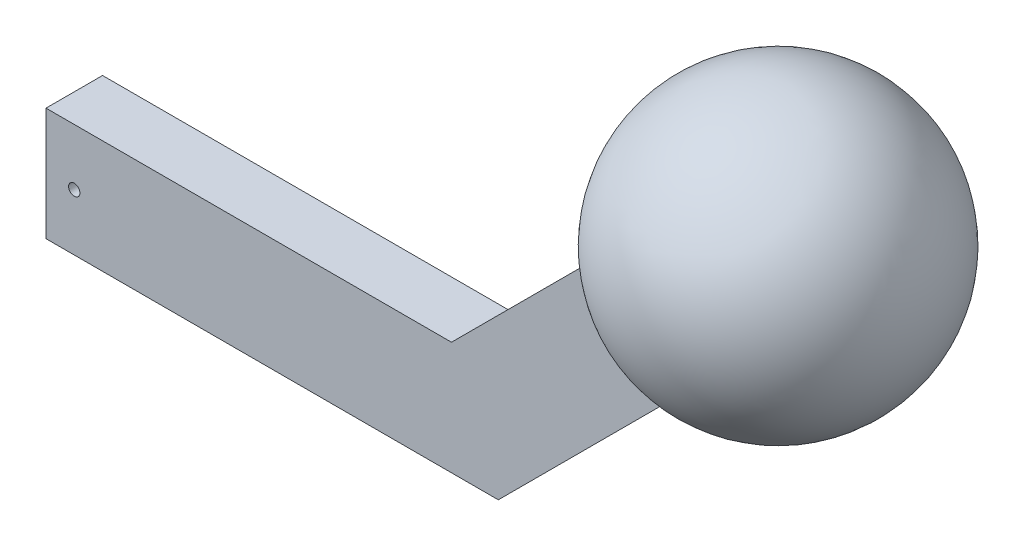
from build123d import *

# Parameters (mm, degrees)
SKETCH1_R           = 1
BOSS_EXTRUDE1_DEPTH = 10
SKETCH4_W           = 23
SKETCH4_H           = 7
CUT_EXTRUDE2_DEPTH  = 2


with BuildPart() as part:
    # Sketch1 → Boss-Extrude1 (new body)
    with BuildSketch(Plane.XY):
        Polygon((0, 0), (80, 0), (115.355339059, 35.355339059), (101.213203436, 49.497474683), (71.715728753, 20), (0, 20), align=None)
        with Locations((5, 10)):
            Circle(SKETCH1_R, mode=Mode.SUBTRACT)
    extrude(amount=BOSS_EXTRUDE1_DEPTH)

    # Sketch2 → Revolve2 (revolve)
    with BuildSketch(Plane.XY.offset(5)):
        with BuildLine():
            Line((108.284271247, 42.426406871), (142.163792523, 76.305928147))
            ThreePointArc((142.163792523, 76.305928147), (145.402623657, 44.93519468), (115.355339059, 35.355339059))
            Line((115.355339059, 35.355339059), (108.284271247, 42.426406871))
        make_face()
    revolve(axis=Axis((108.284271247, 42.426406871, 5), (0.7071067811865456, 0.7071067811865495, 0)))

    # Sketch4 → Cut-Extrude2 (cut)
    with BuildSketch(Plane(origin=(0, 0, 0), x_dir=(-1, 0, 0), z_dir=(0, 0, -1))):
        with Locations((-11.5, 10)):
            Rectangle(SKETCH4_W, SKETCH4_H)
    extrude(amount=-CUT_EXTRUDE2_DEPTH, mode=Mode.SUBTRACT)


solid = part.part
